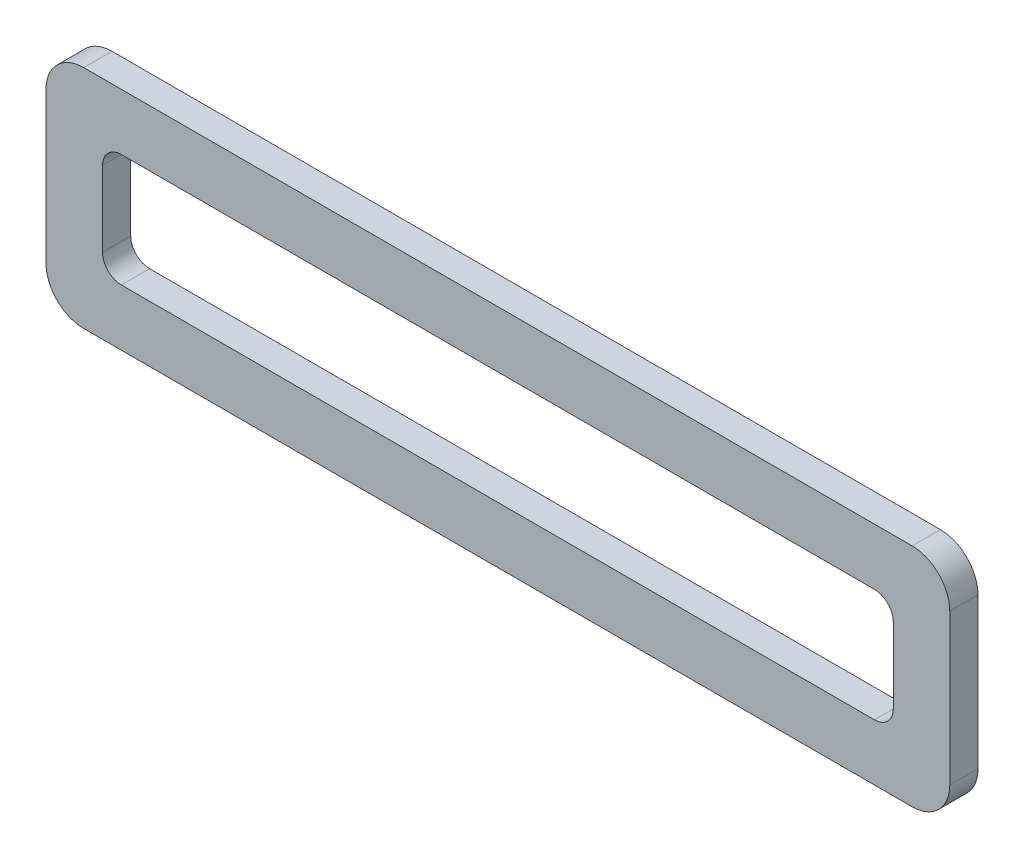
from build123d import *

# Parameters (mm, degrees)
SKETCH1_W           = 304.8
SKETCH1_H           = 76.2
SKETCH1_W_2         = 266.7
SKETCH1_H_2         = 38.1
BOSS_EXTRUDE1_DEPTH = 9.525
FILLET1_R           = 12.7
FILLET2_R           = 6.35


with BuildPart() as part:
    # Sketch1 → Boss-Extrude1 (new body)
    with BuildSketch(Plane.XY):
        Rectangle(SKETCH1_W, SKETCH1_H)
        Rectangle(SKETCH1_W_2, SKETCH1_H_2, mode=Mode.SUBTRACT)
    extrude(amount=BOSS_EXTRUDE1_DEPTH)

    # Fillet1
    fillet1_edges = [part.edges().sort_by_distance(p)[0] for p in [
        (152.4, -38.1, 4.7625),
        (-152.4, -38.1, 4.7625),
        (-152.4, 38.1, 4.7625),
        (152.4, 38.1, 4.7625),
    ]]
    fillet(fillet1_edges, radius=FILLET1_R)

    # Fillet2
    fillet2_edges = [part.edges().sort_by_distance(p)[0] for p in [
        (133.35, -19.05, 4.7625),
        (133.35, 19.05, 4.7625),
        (-133.35, 19.05, 4.7625),
        (-133.35, -19.05, 4.7625),
    ]]
    fillet(fillet2_edges, radius=FILLET2_R)


solid = part.part
